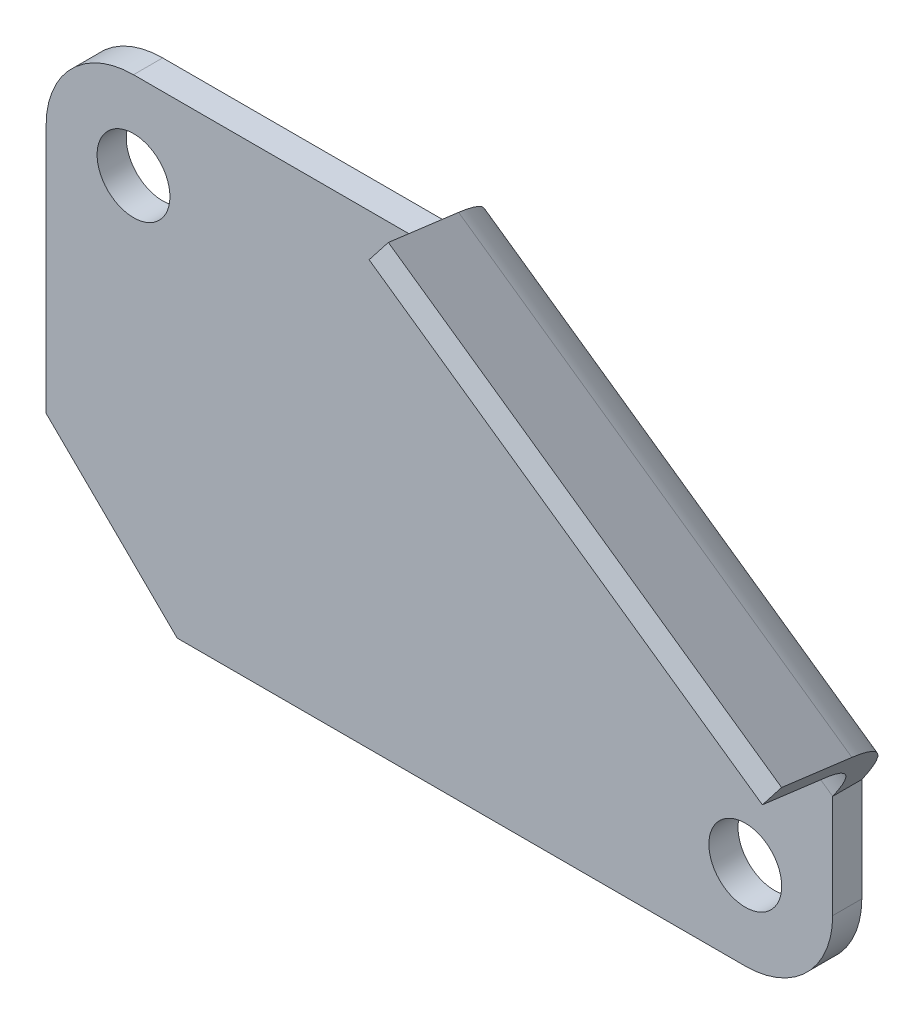
from build123d import *

# Parameters (mm, degrees)
SKETCH1_R           = 5000
BOSS_EXTRUDE1_DEPTH = 4000
BOSS_EXTRUDE2_DEPTH = 65921.827793


with BuildPart() as part:
    # Sketch1 → Boss-Extrude1 (new body)
    with BuildSketch(Plane.XY):
        with BuildLine():
            Line((11793.278630485, 63786.136250361), (53793.278630484, 63786.136250361))
            Line((53793.278630484, 63786.136250361), (107793.278630484, 25974.929187037))
            Line((107793.278630484, 25974.929187037), (107793.278630484, 11786.136250361))
            ThreePointArc((107793.278630484, 11786.136250361), (104278.560004723, 3300.854876123), (95793.278630484, -213.863749639))
            Line((95793.278630484, -213.863749639), (17793.278630484, -213.863749639))
            Line((17793.278630484, -213.863749639), (-206.721369516, 17513.785772275))
            Line((-206.721369516, 17513.785772275), (-206.721369516, 51786.136250361))
            ThreePointArc((-206.721369516, 51786.136250361), (3307.997256246, 60271.4176246), (11793.278630485, 63786.136250361))
        make_face()
        with Locations((11793.278630484, 51786.136250361)):
            Circle(SKETCH1_R, mode=Mode.SUBTRACT)
        with Locations((95793.278630484, 11786.136250361)):
            Circle(SKETCH1_R, mode=Mode.SUBTRACT)
    extrude(amount=BOSS_EXTRUDE1_DEPTH)

    # Sketch5 → Boss-Extrude2 (add)
    with BuildSketch(Plane(origin=(60126.150977366, -42100.784157887, 0), x_dir=(0, 0, -1), z_dir=(0.8191520442889906, -0.5735764363510479, 0))):
        with BuildLine():
            Line((-4000, 83105.100963292), (0, 83105.100963292))
            ThreePointArc((0, 83105.100963292), (-2487.773930273, 91242.24283732), (-9100.463980983, 96597.093656853))
            Line((-9100.463980983, 96597.093656853), (-21662.380736448, 101672.437472819))
            Line((-21662.380736448, 101672.437472819), (-22572.246739713, 98658.809181653))
            Line((-22572.246739713, 98658.809181653), (-10602.646287059, 93822.776686013))
            ThreePointArc((-10602.646287059, 93822.776686013), (-5783.145186622, 89399.215493737), (-4000, 83105.100963292))
        make_face()
    extrude(amount=-BOSS_EXTRUDE2_DEPTH)


solid = part.part
